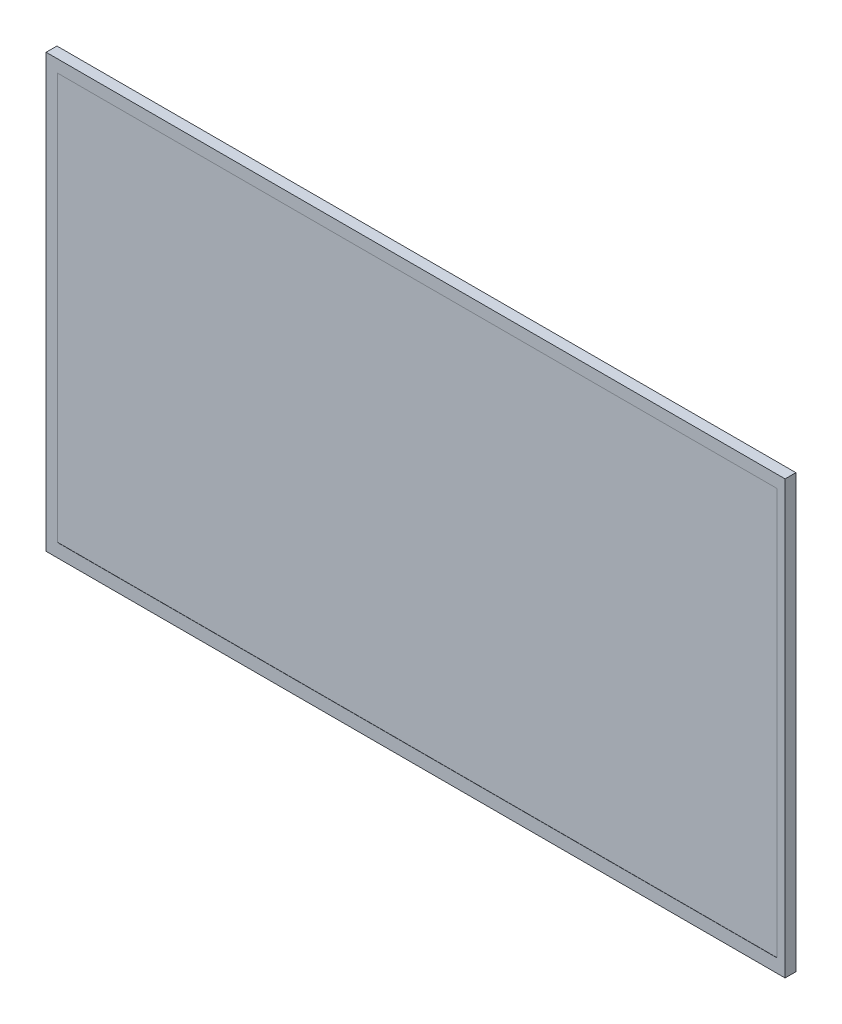
from build123d import *

# Parameters (mm, degrees)
SKETCH2_W           = 359
SKETCH2_H           = 210
BOSS_EXTRUDE1_DEPTH = 5.25
SKETCH3_W           = 349.5
SKETCH3_H           = 197.5
CUT_EXTRUDE1_DEPTH  = 0.1
BOSS_EXTRUDE2_DEPTH = 1
SKETCH5_W           = 226.5
SKETCH5_H           = 41
BOSS_EXTRUDE3_DEPTH = 0.25


with BuildPart() as part:
    # Sketch2 → Boss-Extrude1 (new body)
    with BuildSketch(Plane.XY):
        Rectangle(SKETCH2_W, SKETCH2_H)
    extrude(amount=BOSS_EXTRUDE1_DEPTH)

    # Sketch3 → Cut-Extrude1 (cut)
    with BuildSketch(Plane.XY.offset(5.25)):
        with Locations((0.75, 0.25)):
            Rectangle(SKETCH3_W, SKETCH3_H)
    extrude(amount=-CUT_EXTRUDE1_DEPTH, mode=Mode.SUBTRACT)

    # Sketch4 → Boss-Extrude2 (add)
    with BuildSketch(Plane(origin=(0, 0, 0), x_dir=(-1, 0, 0), z_dir=(0, 0, -1))):
        Polygon((-71.8, -69), (-71.8, -70), (-74.3, -70), (-74.3, -66), (-71.8, -66), (-71.8, -67), (-50.8, -67), (-50.8, -66), (-48.3, -66), (-48.3, -70), (-50.8, -70), (-50.8, -69), align=None)
    extrude(amount=BOSS_EXTRUDE2_DEPTH)

    # Sketch5 → Boss-Extrude3 (add)
    with BuildSketch(Plane(origin=(0, 0, 0), x_dir=(-1, 0, 0), z_dir=(0, 0, -1))):
        with Locations((-0.25, -84.5)):
            Rectangle(SKETCH5_W, SKETCH5_H)
    extrude(amount=BOSS_EXTRUDE3_DEPTH)


solid = part.part
